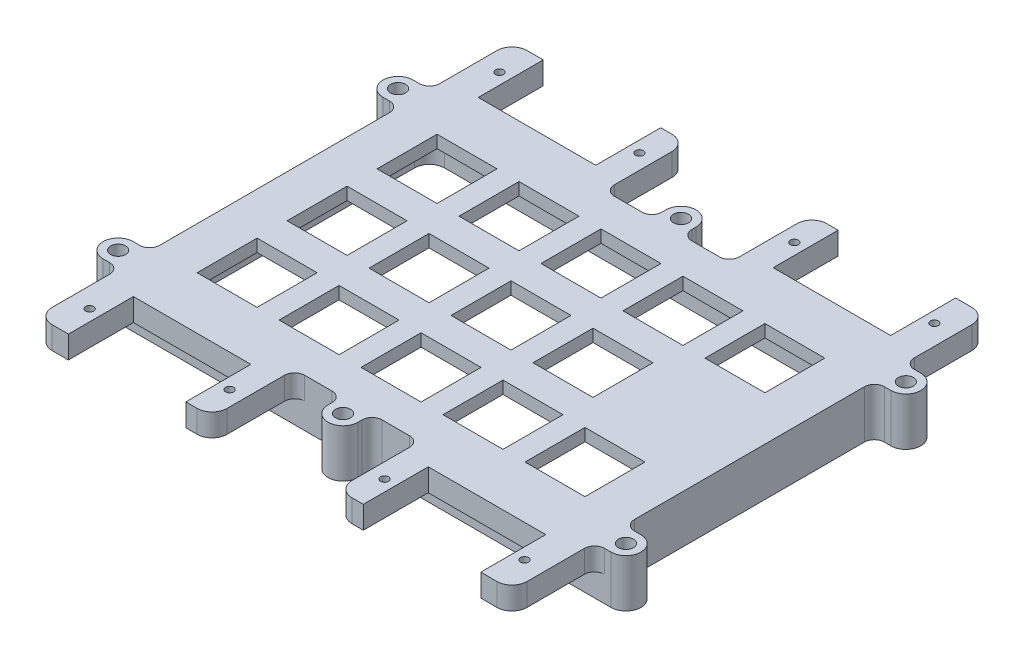
from build123d import *

# Parameters (mm, degrees)
SKETCH_1_R          = 1.5
SKETCH_1_R_2        = 0.8
EXTRUDE_1_DEPTH     = 9.6
CUT_EXTRUDE_START   = -5.1
CUT_EXTRUDE_1_DEPTH = 5.1
SKETCH_3_W          = 90
SKETCH_3_H          = 57
CUT_EXTRUDE_2_DEPTH = 7.1
FILLET_1_R          = 3
FILLET_2_R          = 1
SKETCH_13_W         = 12
SKETCH_13_H         = 12
CUT_EXTRUDE_3_DEPTH = 73.118652234


with BuildPart() as part:
    # 草图1 → 凸台-拉伸1 (new body)
    with BuildSketch(Plane(origin=(0, 0, 0), x_dir=(1, 0, 0), z_dir=(0, 1, 0))):
        with BuildLine():
            Line((-47.5, 23), (-47.5, -23))
            ThreePointArc((-47.5, -23), (-48.085786438, -24.414213562), (-49.5, -25))
            Line((-49.5, -25), (-50.8, -25))
            ThreePointArc((-50.8, -25), (-53.8, -28), (-50.8, -31))
            Line((-50.8, -31), (-49.5, -31))
            ThreePointArc((-49.5, -31), (-48.085786438, -31.585786438), (-47.5, -33))
            Line((-47.5, -33), (-47.5, -44.5))
            ThreePointArc((-47.5, -44.5), (-46.621320344, -46.621320344), (-44.5, -47.5))
            Line((-44.5, -47.5), (-41.25, -47.5))
            Line((-41.25, -47.5), (-41.25, -34.5))
            Line((-41.25, -34.5), (-17.75, -34.5))
            Line((-17.75, -34.5), (-17.75, -47.5))
            Line((-17.75, -47.5), (-15.5, -47.5))
            ThreePointArc((-15.5, -47.5), (-13.378679656, -46.621320344), (-12.5, -44.5))
            Line((-12.5, -44.5), (-12.5, -33))
            ThreePointArc((-12.5, -33), (-11.914213562, -31.585786438), (-10.5, -31))
            Line((-10.5, -31), (-5, -31))
            ThreePointArc((-5, -31), (-3.585786438, -31.585786438), (-3, -33))
            Line((-3, -33), (-3, -33.8))
            ThreePointArc((-3, -33.8), (0, -36.8), (3, -33.8))
            Line((3, -33.8), (3, -33))
            ThreePointArc((3, -33), (3.585786438, -31.585786438), (5, -31))
            Line((5, -31), (10.5, -31))
            ThreePointArc((10.5, -31), (11.914213562, -31.585786438), (12.5, -33))
            Line((12.5, -33), (12.5, -44.5))
            ThreePointArc((12.5, -44.5), (13.378679656, -46.621320344), (15.5, -47.5))
            Line((15.5, -47.5), (17.75, -47.5))
            Line((17.75, -47.5), (17.75, -34.5))
            Line((17.75, -34.5), (41.25, -34.5))
            Line((41.25, -34.5), (41.25, -47.5))
            Line((41.25, -47.5), (44.5, -47.5))
            ThreePointArc((44.5, -47.5), (46.621320344, -46.621320344), (47.5, -44.5))
            Line((47.5, -44.5), (47.5, -33))
            ThreePointArc((47.5, -33), (48.085786438, -31.585786438), (49.5, -31))
            Line((49.5, -31), (50.8, -31))
            ThreePointArc((50.8, -31), (53.8, -28), (50.8, -25))
            Line((50.8, -25), (49.5, -25))
            ThreePointArc((49.5, -25), (48.085786438, -24.414213562), (47.5, -23))
            Line((47.5, -23), (47.5, 23))
            ThreePointArc((47.5, 23), (48.085786438, 24.414213562), (49.5, 25))
            Line((49.5, 25), (50.8, 25))
            ThreePointArc((50.8, 25), (53.8, 28), (50.8, 31))
            Line((50.8, 31), (49.5, 31))
            ThreePointArc((49.5, 31), (48.085786438, 31.585786438), (47.5, 33))
            Line((47.5, 33), (47.5, 44.5))
            ThreePointArc((47.5, 44.5), (46.621320344, 46.621320344), (44.5, 47.5))
            Line((44.5, 47.5), (41.25, 47.5))
            Line((41.25, 47.5), (41.25, 34.5))
            Line((41.25, 34.5), (17.75, 34.5))
            Line((17.75, 34.5), (17.75, 47.5))
            Line((17.75, 47.5), (15.5, 47.5))
            ThreePointArc((15.5, 47.5), (13.378679656, 46.621320344), (12.5, 44.5))
            Line((12.5, 44.5), (12.5, 33))
            ThreePointArc((12.5, 33), (11.914213562, 31.585786438), (10.5, 31))
            Line((10.5, 31), (5, 31))
            ThreePointArc((5, 31), (3.585786438, 31.585786438), (3, 33))
            Line((3, 33), (3, 33.8))
            ThreePointArc((3, 33.8), (0, 36.8), (-3, 33.8))
            Line((-3, 33.8), (-3, 33))
            ThreePointArc((-3, 33), (-3.585786438, 31.585786438), (-5, 31))
            Line((-5, 31), (-10.5, 31))
            ThreePointArc((-10.5, 31), (-11.914213562, 31.585786438), (-12.5, 33))
            Line((-12.5, 33), (-12.5, 44.5))
            ThreePointArc((-12.5, 44.5), (-13.378679656, 46.621320344), (-15.5, 47.5))
            Line((-15.5, 47.5), (-17.75, 47.5))
            Line((-17.75, 47.5), (-17.75, 34.5))
            Line((-17.75, 34.5), (-41.25, 34.5))
            Line((-41.25, 34.5), (-41.25, 47.5))
            Line((-41.25, 47.5), (-44.5, 47.5))
            ThreePointArc((-44.5, 47.5), (-46.621320344, 46.621320344), (-47.5, 44.5))
            Line((-47.5, 44.5), (-47.5, 33))
            ThreePointArc((-47.5, 33), (-48.085786438, 31.585786438), (-49.5, 31))
            Line((-49.5, 31), (-50.8, 31))
            ThreePointArc((-50.8, 31), (-53.8, 28), (-50.8, 25))
            Line((-50.8, 25), (-49.5, 25))
            ThreePointArc((-49.5, 25), (-48.085786438, 24.414213562), (-47.5, 23))
        make_face()
        with Locations(Location((-50.8, 28, 0), (0, 0, 270))):
            Circle(SKETCH_1_R, mode=Mode.SUBTRACT)
        with Locations(Location((50.8, 28, 0), (0, 0, 90))):
            Circle(SKETCH_1_R, mode=Mode.SUBTRACT)
        with Locations(Location((50.8, -28, 0), (0, 0, 270))):
            Circle(SKETCH_1_R, mode=Mode.SUBTRACT)
        with Locations(Location((-50.8, -28, 0), (0, 0, 90))):
            Circle(SKETCH_1_R, mode=Mode.SUBTRACT)
        with Locations(Location((0, 33.8, 0), (0, 0, 270))):
            Circle(SKETCH_1_R, mode=Mode.SUBTRACT)
        with Locations(Location((0, -33.8, 0), (0, 0, 90))):
            Circle(SKETCH_1_R, mode=Mode.SUBTRACT)
        with Locations(Location((43.5, 41, 0), (0, 0, 270))):
            Circle(SKETCH_1_R_2, mode=Mode.SUBTRACT)
        with Locations(Location((15.5, 41, 0), (0, 0, 90))):
            Circle(SKETCH_1_R_2, mode=Mode.SUBTRACT)
        with Locations(Location((43.5, -41, 0), (0, 0, 90))):
            Circle(SKETCH_1_R_2, mode=Mode.SUBTRACT)
        with Locations(Location((15.5, -41, 0), (0, 0, 270))):
            Circle(SKETCH_1_R_2, mode=Mode.SUBTRACT)
        with Locations(Location((-15.5, -41, 0), (0, 0, 90))):
            Circle(SKETCH_1_R_2, mode=Mode.SUBTRACT)
        with Locations(Location((-43.5, -41, 0), (0, 0, 270))):
            Circle(SKETCH_1_R_2, mode=Mode.SUBTRACT)
        with Locations(Location((-43.5, 41, 0), (0, 0, 90))):
            Circle(SKETCH_1_R_2, mode=Mode.SUBTRACT)
        with Locations(Location((-15.5, 41, 0), (0, 0, 270))):
            Circle(SKETCH_1_R_2, mode=Mode.SUBTRACT)
    extrude(amount=-EXTRUDE_1_DEPTH)

    # 草图2 → 切除-拉伸1 (cut)
    with BuildSketch(Plane.XZ.offset(9.6).offset(CUT_EXTRUDE_START)):
        with BuildLine():
            Line((63.557901373, 31), (5, 31))
            ThreePointArc((5, 31), (3.585786438, 31.585786438), (3, 33))
            Line((3, 33), (3, 33.8))
            ThreePointArc((3, 33.8), (0, 36.8), (-3, 33.8))
            Line((-3, 33.8), (-3, 33))
            ThreePointArc((-3, 33), (-3.585786438, 31.585786438), (-5, 31))
            Line((-5, 31), (-73.010332056, 31))
            Line((-73.010332056, 31), (-73.010332056, 53.694218021))
            Line((-73.010332056, 53.694218021), (63.557901373, 53.694218021))
            Line((63.557901373, 53.694218021), (63.557901373, 31))
        make_face()
        with BuildLine():
            Line((63.557901373, -31), (63.557901373, -53.694218021))
            Line((63.557901373, -53.694218021), (-73.010332056, -53.694218021))
            Line((-73.010332056, -53.694218021), (-73.010332056, -31))
            Line((-73.010332056, -31), (-5, -31))
            ThreePointArc((-5, -31), (-3.585786438, -31.585786438), (-3, -33))
            Line((-3, -33), (-3, -33.8))
            ThreePointArc((-3, -33.8), (0, -36.8), (3, -33.8))
            Line((3, -33.8), (3, -33))
            ThreePointArc((3, -33), (3.585786438, -31.585786438), (5, -31))
            Line((5, -31), (63.557901373, -31))
        make_face()
    extrude(amount=CUT_EXTRUDE_1_DEPTH, mode=Mode.SUBTRACT)

    # 草图3 → 切除-拉伸2 (cut)
    with BuildSketch(Plane.XZ.offset(9.6)):
        Rectangle(SKETCH_3_W, SKETCH_3_H)
    extrude(amount=-CUT_EXTRUDE_2_DEPTH, mode=Mode.SUBTRACT)

    # 圆角1
    fillet_1_edges = [part.edges().sort_by_distance(p)[0] for p in [
        (45, -6.05, 28.5),
        (45, -6.05, -28.5),
        (-45, -6.05, -28.5),
        (-45, -6.05, 28.5),
    ]]
    fillet(fillet_1_edges, radius=FILLET_1_R)

    # 圆角2
    fillet_2_edges = [part.edges().sort_by_distance(p)[0] for p in [
        (0, -2.5, -28.5),
        (-45, -2.5, 0),
        (45, -2.5, 0),
        (0, -2.5, 28.5),
        (44.121320344, -2.5, 27.621320344),
        (44.121320344, -2.5, -27.621320344),
        (-44.121320344, -2.5, 27.621320344),
        (-44.121320344, -2.5, -27.621320344),
    ]]
    fillet(fillet_2_edges, radius=FILLET_2_R)

    # 草图13 → 切除-拉伸3 (cut, through all)
    with BuildSketch(Plane.XZ.offset(2.5)):
        with Locations((-33, 18)):
            Rectangle(SKETCH_13_W, SKETCH_13_H)
        with Locations((-16.6, 18)):
            Rectangle(SKETCH_13_W, SKETCH_13_H)
        with Locations((-0.2, 18)):
            Rectangle(SKETCH_13_W, SKETCH_13_H)
        with Locations((16.2, 18)):
            Rectangle(SKETCH_13_W, SKETCH_13_H)
        with Locations((32.6, 18)):
            Rectangle(SKETCH_13_W, SKETCH_13_H)
        with Locations((-16.6, 0)):
            Rectangle(SKETCH_13_W, SKETCH_13_H)
        with Locations((-0.2, 0)):
            Rectangle(SKETCH_13_W, SKETCH_13_H)
        with Locations((16.2, 0)):
            Rectangle(SKETCH_13_W, SKETCH_13_H)
        with Locations((-16.6, -18)):
            Rectangle(SKETCH_13_W, SKETCH_13_H)
        with Locations((-0.2, -18)):
            Rectangle(SKETCH_13_W, SKETCH_13_H)
        with Locations((16.2, -18)):
            Rectangle(SKETCH_13_W, SKETCH_13_H)
        with Locations((32.6, -18)):
            Rectangle(SKETCH_13_W, SKETCH_13_H)
        with Locations((-33, 0)):
            Rectangle(SKETCH_13_W, SKETCH_13_H)
        with Locations((-33, -18)):
            Rectangle(SKETCH_13_W, SKETCH_13_H)
    extrude(amount=-CUT_EXTRUDE_3_DEPTH, mode=Mode.SUBTRACT)


solid = part.part
